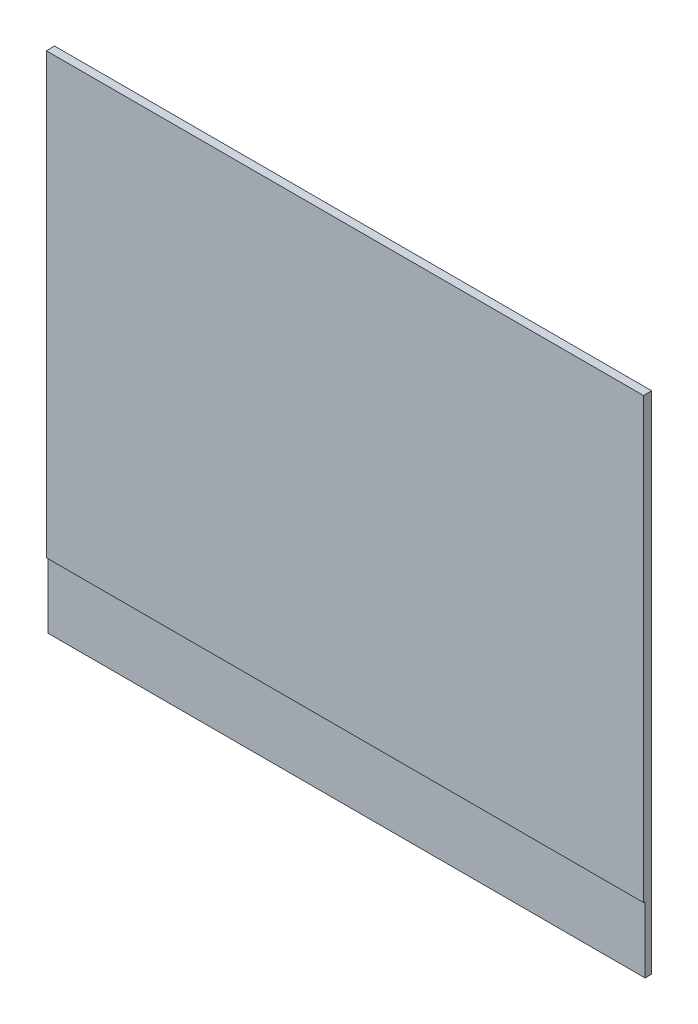
from build123d import *

# Parameters (mm, degrees)
ESQUISSE1_W             = 91
ESQUISSE1_H             = 77
BOSS_EXTRU_1_DEPTH      = 1.25
ESQUISSE2_W             = 91
ESQUISSE2_H             = 10.088688792
ENL_V_MAT_EXTRU_1_DEPTH = 0.25


with BuildPart() as part:
    # Esquisse1 → Boss.-Extru.1 (new body)
    with BuildSketch(Plane.XY):
        with Locations((45.5, 38.5)):
            Rectangle(ESQUISSE1_W, ESQUISSE1_H)
    extrude(amount=BOSS_EXTRU_1_DEPTH)

    # Esquisse2 → Enlèv. mat.-Extru.1 (cut)
    with BuildSketch(Plane.XY.offset(1.25)):
        with Locations((45.5, 5.044344396)):
            Rectangle(ESQUISSE2_W, ESQUISSE2_H)
    extrude(amount=-ENL_V_MAT_EXTRU_1_DEPTH, mode=Mode.SUBTRACT)


solid = part.part
